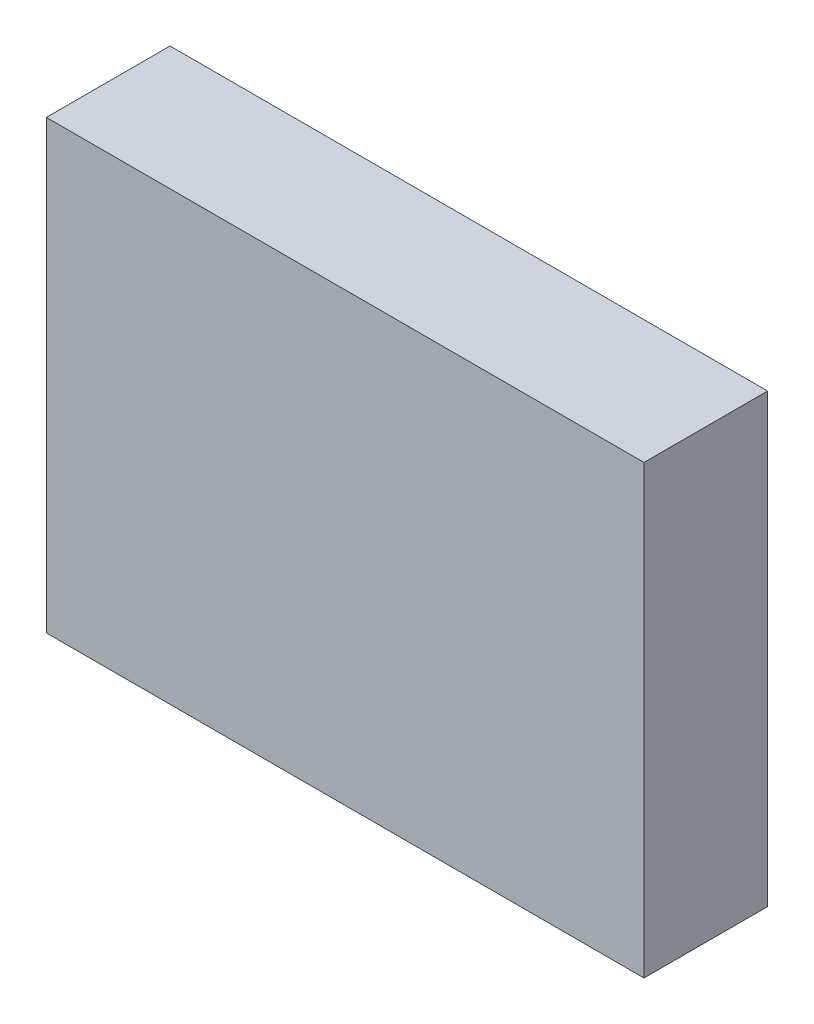
from build123d import *

# Parameters (mm, degrees)
SKETCH_1_W      = 87
SKETCH_1_H      = 65
EXTRUDE_1_DEPTH = 18


with BuildPart() as part:
    # 草图1 → 凸台-拉伸1 (new body)
    with BuildSketch(Plane.XY):
        Rectangle(SKETCH_1_W, SKETCH_1_H)
    extrude(amount=EXTRUDE_1_DEPTH)


solid = part.part
